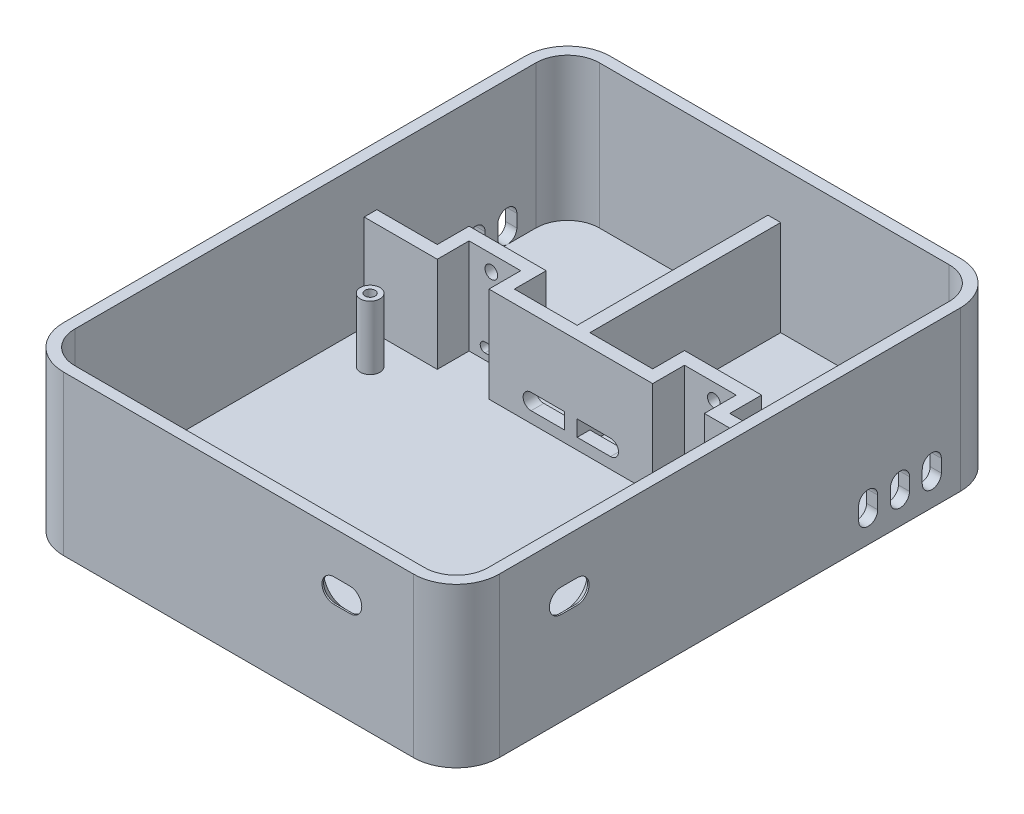
from build123d import *

# Parameters (mm, degrees)
BOSS_EXTRUDE1_DEPTH = 5
BOSS_EXTRUDE2_DEPTH = 30
SKETCH3_R           = 2
CUT_EXTRUDE1_DEPTH  = 126.103956772
BOSS_EXTRUDE3_DEPTH = 50
SKETCH7_R           = 3.0875
SKETCH7_R_2         = 1.5875
BOSS_EXTRUDE4_DEPTH = 20
SKETCH9_W           = 4
SKETCH9_H           = 67.5
BOSS_EXTRUDE5_DEPTH = 30
CUT_EXTRUDE2_DEPTH  = 20
CUT_EXTRUDE3_DEPTH  = 10
CHAMFER1_SIZE       = 3
CUT_EXTRUDE4_DEPTH  = 121.781828103
CHAMFER2_SIZE       = 3


with BuildPart() as part:
    # Sketch1 → Boss-Extrude1 (new body)
    with BuildSketch(Plane(origin=(0, 0, 0), x_dir=(1, 0, 0), z_dir=(0, 1, 0))):
        with BuildLine():
            Line((-55, -82.5), (55, -82.5))
            ThreePointArc((55, -82.5), (62.071067812, -79.571067812), (65, -72.5))
            Line((65, -72.5), (65, 72.5))
            ThreePointArc((65, 72.5), (62.071067812, 79.571067812), (55, 82.5))
            Line((55, 82.5), (-55, 82.5))
            ThreePointArc((-55, 82.5), (-62.071067812, 79.571067812), (-65, 72.5))
            Line((-65, 72.5), (-65, -72.5))
            ThreePointArc((-65, -72.5), (-62.071067812, -79.571067812), (-55, -82.5))
        make_face()
    extrude(amount=BOSS_EXTRUDE1_DEPTH)

    # Sketch2 → Boss-Extrude2 (add)
    with BuildSketch(Plane(origin=(0, 5, 0), x_dir=(1, 0, 0), z_dir=(0, 1, 0))):
        Polygon((-65, 18.5), (-42, 18.5), (-42, 28.5), (-25.74846966, 28.5), (-25.74846966, 18.5), (25.74846966, 18.5), (25.74846966, 28.5), (42, 28.5), (42, 18.5), (65, 18.5), (65, 22.5), (46, 22.5), (46, 32.5), (21.74846966, 32.5), (21.74846966, 22.5), (-21.74846966, 22.5), (-21.74846966, 32.5), (-46, 32.5), (-46, 22.5), (-65, 22.5), align=None)
    extrude(amount=BOSS_EXTRUDE2_DEPTH)

    # Sketch3 → Cut-Extrude1 (cut, through all)
    with BuildSketch(Plane.XY.offset(-18.5)):
        with Locations((35, 30)):
            Circle(SKETCH3_R)
        with Locations((-35, 30)):
            Circle(SKETCH3_R)
        with BuildLine():
            Line((-12.5, 13.50518346), (12.5, 13.50518346))
            ThreePointArc((12.5, 13.50518346), (15.00518346, 11), (12.5, 8.49481654))
            Line((12.5, 8.49481654), (-12.5, 8.49481654))
            ThreePointArc((-12.5, 8.49481654), (-15.00518346, 11), (-12.5, 13.50518346))
        make_face()
        with BuildLine():
            Line((33, 9.98963308), (37, 9.98963308))
            ThreePointArc((37, 9.98963308), (38.49481654, 8.49481654), (37, 7))
            Line((37, 7), (33, 7))
            ThreePointArc((33, 7), (31.50518346, 8.49481654), (33, 9.98963308))
        make_face()
        with BuildLine():
            Line((-33, 9.98963308), (-37, 9.98963308))
            ThreePointArc((-37, 9.98963308), (-38.49481654, 8.49481654), (-37, 7))
            Line((-37, 7), (-33, 7))
            ThreePointArc((-33, 7), (-31.50518346, 8.49481654), (-33, 9.98963308))
        make_face()
    extrude(amount=-CUT_EXTRUDE1_DEPTH, mode=Mode.SUBTRACT)

    # Sketch1<3> → Boss-Extrude3 (add)
    with BuildSketch(Plane(origin=(0, 0, 0), x_dir=(1, 0, 0), z_dir=(0, 1, 0))):
        with BuildLine():
            Line((-68.5, -72.5), (-68.5, 72.5))
            ThreePointArc((-68.5, 72.5), (-64.545941546, 82.045941546), (-55, 86))
            Line((-55, 86), (55, 86))
            ThreePointArc((55, 86), (64.545941546, 82.045941546), (68.5, 72.5))
            Line((68.5, 72.5), (68.5, -72.5))
            ThreePointArc((68.5, -72.5), (64.545941546, -82.045941546), (55, -86))
            Line((55, -86), (-55, -86))
            ThreePointArc((-55, -86), (-64.545941546, -82.045941546), (-68.5, -72.5))
        make_face()
        with BuildLine():
            Line((-55, -82.5), (55, -82.5))
            ThreePointArc((55, -82.5), (62.071067812, -79.571067812), (65, -72.5))
            Line((65, -72.5), (65, 72.5))
            ThreePointArc((65, 72.5), (62.071067812, 79.571067812), (55, 82.5))
            Line((55, 82.5), (-55, 82.5))
            ThreePointArc((-55, 82.5), (-62.071067812, 79.571067812), (-65, 72.5))
            Line((-65, 72.5), (-65, -72.5))
            ThreePointArc((-65, -72.5), (-62.071067812, -79.571067812), (-55, -82.5))
        make_face(mode=Mode.SUBTRACT)
    extrude(amount=BOSS_EXTRUDE3_DEPTH)

    # Sketch7 → Boss-Extrude4 (add)
    # profile 1 of 4: a face of its own
    with BuildSketch(Plane(origin=(0, 5, 0), x_dir=(1, 0, 0), z_dir=(0, 1, 0))):
        with Locations((-53.3075, -72.59)):
            Circle(SKETCH7_R)
        with Locations((-53.3075, -72.59)):
            Circle(SKETCH7_R_2, mode=Mode.SUBTRACT)
    # profile 2 of 4: a face of its own
    with BuildSketch(Plane(origin=(0, 5, 0), x_dir=(1, 0, 0), z_dir=(0, 1, 0))):
        with Locations((53.3725, -72.59)):
            Circle(SKETCH7_R)
        with Locations((53.3725, -72.59)):
            Circle(SKETCH7_R_2, mode=Mode.SUBTRACT)
    # profile 3 of 4: a face of its own
    with BuildSketch(Plane(origin=(0, 5, 0), x_dir=(1, 0, 0), z_dir=(0, 1, 0))):
        with Locations((-53.3075, 8.69)):
            Circle(SKETCH7_R)
        with Locations((-53.3075, 8.69)):
            Circle(SKETCH7_R_2, mode=Mode.SUBTRACT)
    # profile 4 of 4: a face of its own
    with BuildSketch(Plane(origin=(0, 5, 0), x_dir=(1, 0, 0), z_dir=(0, 1, 0))):
        with Locations((53.3725, 8.69)):
            Circle(SKETCH7_R)
        with Locations((53.3725, 8.69)):
            Circle(SKETCH7_R_2, mode=Mode.SUBTRACT)
    extrude(amount=BOSS_EXTRUDE4_DEPTH)

    # Sketch9 → Boss-Extrude5 (add)
    with BuildSketch(Plane(origin=(0, 35, 0), x_dir=(1, 0, 0), z_dir=(0, 1, 0))):
        with Locations((0, 52.25)):
            Rectangle(SKETCH9_W, SKETCH9_H)
    extrude(amount=-BOSS_EXTRUDE5_DEPTH)

    # Sketch11 → Cut-Extrude2 (cut)
    with BuildSketch(Plane.ZY.offset(68.5)):
        with BuildLine():
            Line((-66.522203209, 8), (-66.522203209, 12))
            ThreePointArc((-66.522203209, 12), (-63.522203209, 15), (-60.522203209, 12))
            Line((-60.522203209, 12), (-60.522203209, 8))
            ThreePointArc((-60.522203209, 8), (-63.522203209, 5), (-66.522203209, 8))
        make_face()
        with BuildLine():
            Line((-50.522203209, 8), (-50.522203209, 12))
            ThreePointArc((-50.522203209, 12), (-53.522203209, 15), (-56.522203209, 12))
            Line((-56.522203209, 12), (-56.522203209, 8))
            ThreePointArc((-56.522203209, 8), (-53.522203209, 5), (-50.522203209, 8))
        make_face()
        with BuildLine():
            Line((-40.522203209, 8), (-40.522203209, 12))
            ThreePointArc((-40.522203209, 12), (-43.522203209, 15), (-46.522203209, 12))
            Line((-46.522203209, 12), (-46.522203209, 8))
            ThreePointArc((-46.522203209, 8), (-43.522203209, 5), (-40.522203209, 8))
        make_face()
    cut_extrude2 = extrude(amount=-CUT_EXTRUDE2_DEPTH, mode=Mode.SUBTRACT)

    # Mirror1: Cut-Extrude2 across plane
    add(cut_extrude2.mirror(Plane(origin=(2, 5, -86), x_dir=(0, 0, 1), z_dir=(1, 0, 0))), mode=Mode.SUBTRACT)

    # Sketch12 → Cut-Extrude3 (cut)
    with BuildSketch(Plane(origin=(68.5, 0, 0), x_dir=(0, 0, -1), z_dir=(1, 0, 0))):
        with BuildLine():
            Line((-53, 36.75), (-48, 36.75))
            ThreePointArc((-48, 36.75), (-44.25, 33), (-48, 29.25))
            Line((-48, 29.25), (-53, 29.25))
            ThreePointArc((-53, 29.25), (-56.75, 33), (-53, 36.75))
        make_face()
    extrude(amount=-CUT_EXTRUDE3_DEPTH, mode=Mode.SUBTRACT)

    # Chamfer1
    chamfer1_edges = [part.edges().sort_by_distance(p)[0] for p in [
        (65, 36.75, 50.5),
        (65, 33, 44.25),
        (65, 33, 56.75),
        (65, 29.25, 50.5),
    ]]
    chamfer(chamfer1_edges, length=CHAMFER1_SIZE)

    # Sketch13 → Cut-Extrude4 (cut, through all)
    with BuildSketch(Plane.XY):
        with BuildLine():
            Line((30, 36.75), (35, 36.75))
            ThreePointArc((35, 36.75), (38.75, 33), (35, 29.25))
            Line((35, 29.25), (30, 29.25))
            ThreePointArc((30, 29.25), (26.25, 33), (30, 36.75))
        make_face()
    extrude(amount=CUT_EXTRUDE4_DEPTH, mode=Mode.SUBTRACT)

    # Chamfer2
    chamfer2_edges = [part.edges().sort_by_distance(p)[0] for p in [
        (32.5, 36.75, 82.5),
        (26.25, 33, 82.5),
        (38.75, 33, 82.5),
        (32.5, 29.25, 82.5),
    ]]
    chamfer(chamfer2_edges, length=CHAMFER2_SIZE)


solid = part.part
